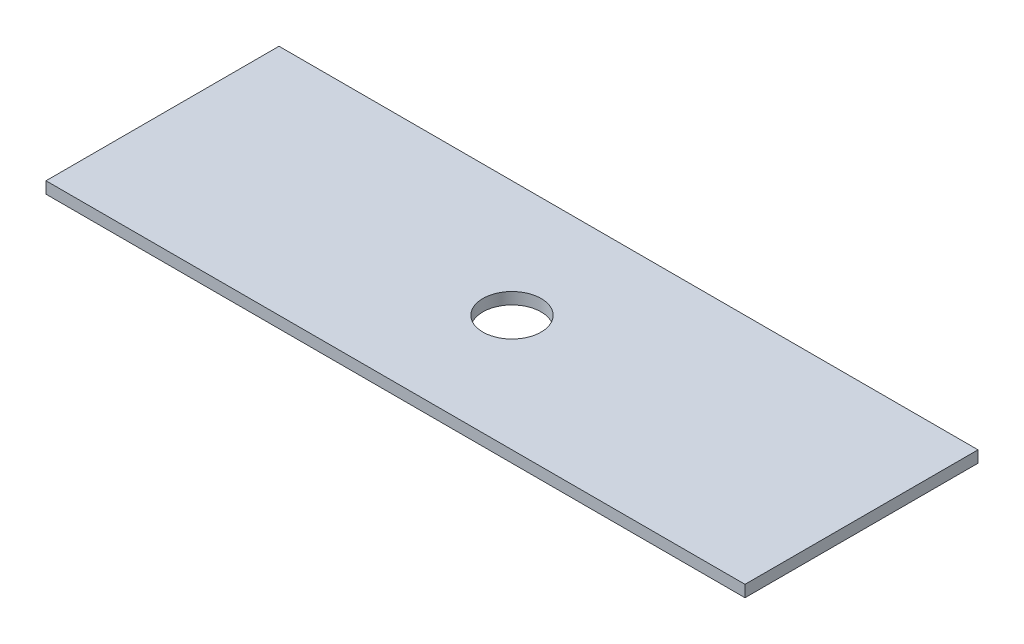
from build123d import *

# Parameters (mm, degrees)
SKETCH1_W           = 152.4
SKETCH1_H           = 50.8
SKETCH1_R           = 6.35
BOSS_EXTRUDE1_DEPTH = 2.54


with BuildPart() as part:
    # Sketch1 → Boss-Extrude1 (new body)
    with BuildSketch(Plane(origin=(0, 0, 0), x_dir=(1, 0, 0), z_dir=(0, 1, 0))):
        with Locations((76.2, 25.4)):
            Rectangle(SKETCH1_W, SKETCH1_H)
        with Locations(Location((76.2, 25.4, 0), (0, 0, 270))):
            Circle(SKETCH1_R, mode=Mode.SUBTRACT)
    extrude(amount=BOSS_EXTRUDE1_DEPTH)


solid = part.part
